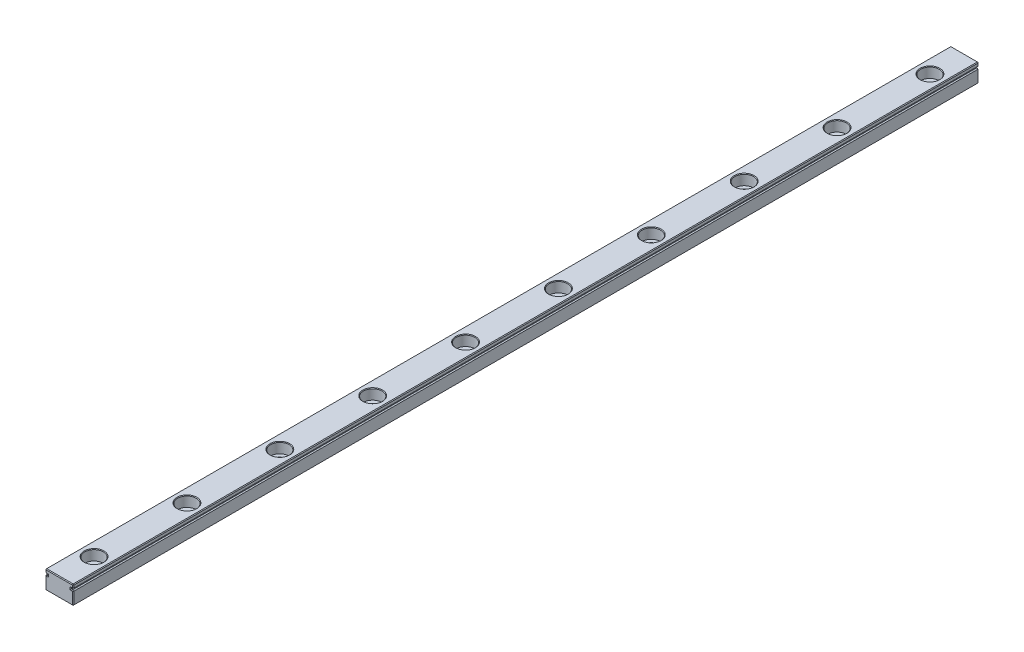
from build123d import *

# Parameters (mm, degrees)
BOSS_EXTRUDE1_DEPTH = 390
CHAMFER1_SIZE       = 0.3
LPATTERN1_COUNT     = 10
LPATTERN1_PITCH     = 40


with BuildPart() as part:
    # Sketch1 → Boss-Extrude1 (new body)
    with BuildSketch(Plane.XY):
        with BuildLine():
            Line((0, 8), (12, 8))
            Line((12, 8), (12, 6.75))
            Line((12, 6.75), (12, 6.559016994))
            ThreePointArc((12, 6.559016994), (11.706107374, 6.475528258), (11.5, 6.25))
            Line((11.5, 6.25), (11, 6.25))
            Line((11, 6.25), (11, 5.75))
            Line((11, 5.75), (11.5, 5.75))
            ThreePointArc((11.5, 5.75), (11.706107374, 5.524471742), (12, 5.440983006))
            Line((12, 5.440983006), (12, 5.25))
            Line((12, 5.25), (12, 0))
            Line((12, 0), (0, 0))
            Line((0, 0), (0, 5.25))
            Line((0, 5.25), (0, 5.440983006))
            ThreePointArc((0, 5.440983006), (0.293892626, 5.524471742), (0.5, 5.75))
            Line((0.5, 5.75), (1, 5.75))
            Line((1, 5.75), (1, 6.25))
            Line((1, 6.25), (0.5, 6.25))
            ThreePointArc((0.5, 6.25), (0.293892626, 6.475528258), (0, 6.559016994))
            Line((0, 6.559016994), (0, 6.75))
            Line((0, 6.75), (0, 8))
        make_face()
    extrude(amount=BOSS_EXTRUDE1_DEPTH)

    # Chamfer1
    chamfer1_edges = [part.edges().sort_by_distance(p)[0] for p in [
        (12, 2.720491503, 390),
        (11.706107374, 5.524471742, 390),
        (0, 2.720491503, 0),
        (0.293892626, 5.524471742, 0),
        (0.75, 5.75, 0),
        (1, 6, 0),
        (0.75, 6.25, 0),
        (11.25, 5.75, 390),
        (0.293892626, 6.475528258, 0),
        (0, 7.279508497, 0),
        (6, 8, 0),
        (12, 7.279508497, 0),
        (11.706107374, 6.475528258, 0),
        (11, 6, 390),
        (11.25, 6.25, 0),
        (11, 6, 0),
        (11.25, 5.75, 0),
        (11.706107374, 5.524471742, 0),
        (12, 2.720491503, 0),
        (6, 0, 0),
        (11.25, 6.25, 390),
        (11.706107374, 6.475528258, 390),
        (12, 7.279508497, 390),
        (0, 8, 195),
        (12, 8, 195),
        (12, 0, 195),
        (0, 0, 195),
        (6, 8, 390),
        (0, 2.720491503, 390),
        (0, 7.279508497, 390),
        (0.293892626, 6.475528258, 390),
        (0.75, 6.25, 390),
        (1, 6, 390),
        (0.75, 5.75, 390),
        (0.293892626, 5.524471742, 390),
        (6, 0, 390),
    ]]
    chamfer(chamfer1_edges, length=CHAMFER1_SIZE)

    # Sketch3 → CBORE for M5 Hex Head Bolt1 (revolve, cut)
    with BuildSketch(Plane(origin=(6, 8, 15), x_dir=(0, 0, 1), z_dir=(1, 0, 0))):
        Polygon((0, 0), (0, 8), (2.5, 8), (2.25, 7.75), (2.25, 4.5), (4, 4.5), (4, 0.25), (4.25, 0), align=None)
    cbore_for_m5_hex_head_bolt1 = revolve(axis=Axis((6, 14.35, 15), (0, -1, 0)), mode=Mode.SUBTRACT)

    # LPattern1: CBORE for M5 Hex Head Bolt1 ×10
    with Locations(*[(0, 0, i * LPATTERN1_PITCH) for i in range(1, LPATTERN1_COUNT)]):
        add(cbore_for_m5_hex_head_bolt1, mode=Mode.SUBTRACT)


solid = part.part
